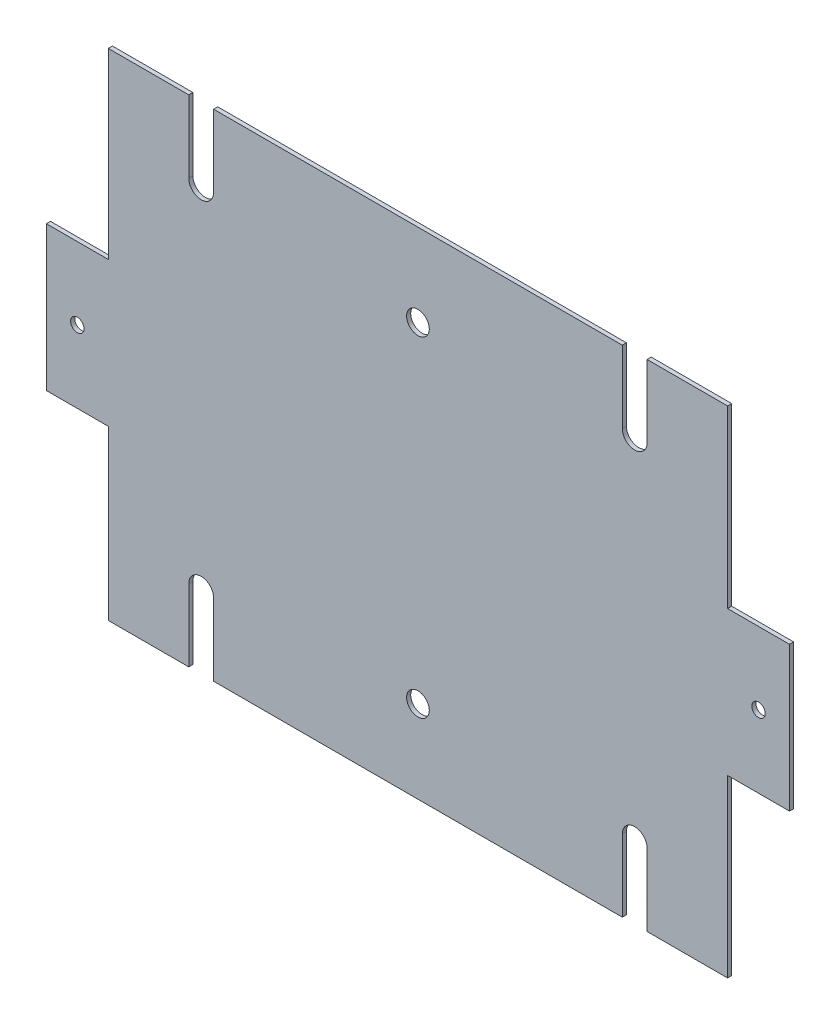
from build123d import *

# Parameters (mm, degrees)
SKETCH1_R           = 5.5
SKETCH1_R_2         = 3.25
BOSS_EXTRUDE1_DEPTH = 2


with BuildPart() as part:
    # Sketch1 → Boss-Extrude1 (new body)
    with BuildSketch(Plane.XY):
        with BuildLine():
            Line((68.948821818, -26.633764286), (98.948821818, -26.633764286))
            Line((98.948821818, -26.633764286), (98.948821818, -96.633764286))
            Line((98.948821818, -96.633764286), (68.948821818, -96.633764286))
            Line((68.948821818, -96.633764286), (68.948821818, -181.633764286))
            Line((68.948821818, -181.633764286), (29.948821818, -181.633764286))
            Line((29.948821818, -181.633764286), (29.948821818, -146.633764286))
            ThreePointArc((29.948821818, -146.633764286), (23.948821818, -140.633764286), (17.948821818, -146.633764286))
            Line((17.948821818, -146.633764286), (17.948821818, -181.633764286))
            Line((17.948821818, -181.633764286), (-180.051178182, -181.633764286))
            Line((-180.051178182, -181.633764286), (-180.051178182, -146.633764286))
            ThreePointArc((-180.051178182, -146.633764286), (-186.051178182, -140.633764286), (-192.051178182, -146.633764286))
            Line((-192.051178182, -146.633764286), (-192.051178182, -181.633764286))
            Line((-192.051178182, -181.633764286), (-231.051178182, -181.633764286))
            Line((-231.051178182, -181.633764286), (-231.051178182, -100.179856115))
            Line((-231.051178182, -100.179856115), (-261.051178182, -100.179856115))
            Line((-261.051178182, -100.179856115), (-261.051178182, -30.179856115))
            Line((-261.051178182, -30.179856115), (-231.051178182, -30.179856115))
            Line((-231.051178182, -30.179856115), (-231.051178182, 58.366235714))
            Line((-231.051178182, 58.366235714), (-192.051178182, 58.366235714))
            Line((-192.051178182, 58.366235714), (-192.051178182, 23.366235714))
            ThreePointArc((-192.051178182, 23.366235714), (-186.051178182, 17.366235714), (-180.051178182, 23.366235714))
            Line((-180.051178182, 23.366235714), (-180.051178182, 58.366235714))
            Line((-180.051178182, 58.366235714), (17.948821818, 58.366235714))
            Line((17.948821818, 58.366235714), (17.948821818, 23.366235714))
            ThreePointArc((17.948821818, 23.366235714), (23.948821818, 17.366235714), (29.948821818, 23.366235714))
            Line((29.948821818, 23.366235714), (29.948821818, 58.366235714))
            Line((29.948821818, 58.366235714), (68.948821818, 58.366235714))
            Line((68.948821818, 58.366235714), (68.948821818, -26.633764286))
        make_face()
        with Locations((-81.051178182, -141.633764286)):
            Circle(SKETCH1_R, mode=Mode.SUBTRACT)
        with Locations((-81.051178182, 18.366235714)):
            Circle(SKETCH1_R, mode=Mode.SUBTRACT)
        with Locations((83.948821818, -61.633764286)):
            Circle(SKETCH1_R_2, mode=Mode.SUBTRACT)
        with Locations((-246.051178182, -65.179856115)):
            Circle(SKETCH1_R_2, mode=Mode.SUBTRACT)
    extrude(amount=BOSS_EXTRUDE1_DEPTH)


solid = part.part
